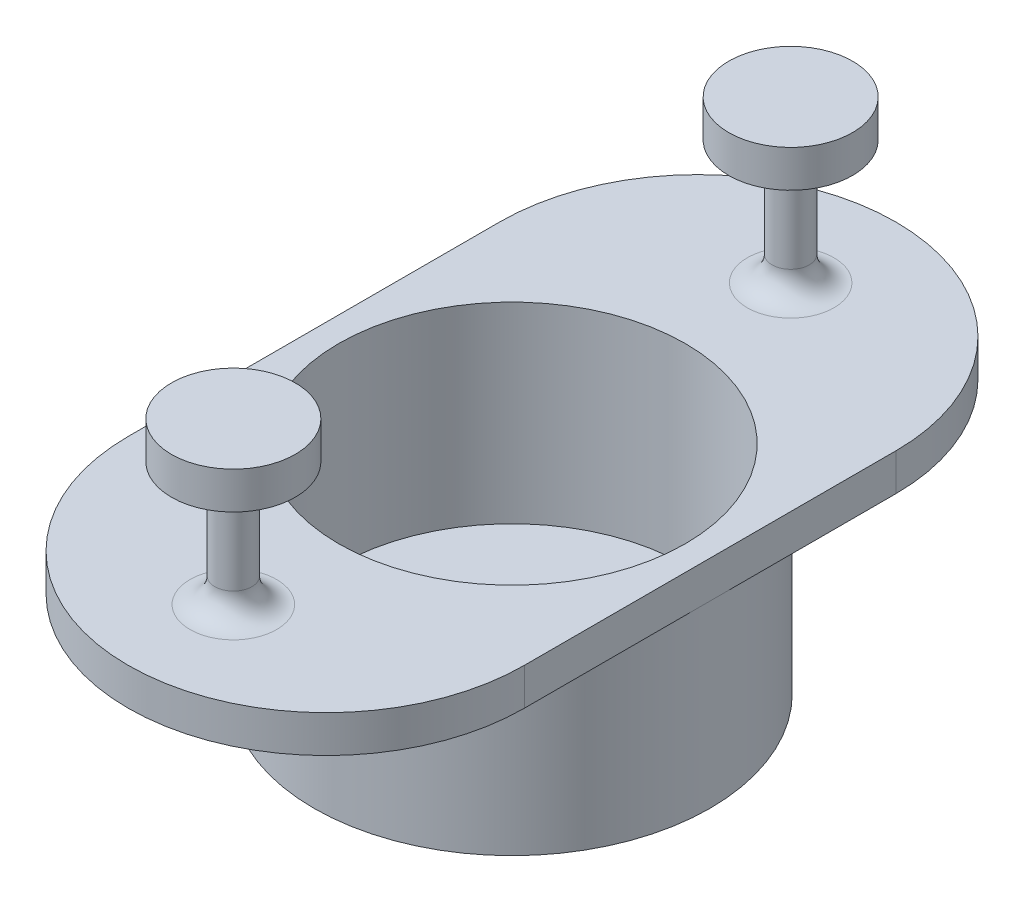
from build123d import *

# Parameters (mm, degrees)
SKETCH1_R           = 16
BOSS_EXTRUDE1_DEPTH = 14.5
BOSS_EXTRUDE2_DEPTH = 3
SKETCH3_R           = 1.5
BOSS_EXTRUDE3_DEPTH = 10
SKETCH4_R           = 14
CUT_EXTRUDE1_DEPTH  = 15.5
SKETCH5_R           = 1.5
CUT_EXTRUDE2_DEPTH  = 44.211688234
SKETCH7_R           = 5
BOSS_EXTRUDE4_DEPTH = 3
FILLET1_R           = 2


with BuildPart() as part:
    # Sketch1 → Boss-Extrude1 (new body)
    with BuildSketch(Plane(origin=(0, 0, 0), x_dir=(1, 0, 0), z_dir=(0, 1, 0))):
        with Locations(Location((0, 0, 0), (0, 0, 90))):
            Circle(SKETCH1_R)
    extrude(amount=BOSS_EXTRUDE1_DEPTH)

    # Sketch2 → Boss-Extrude2 (add)
    with BuildSketch(Plane(origin=(0, 14.5, 0), x_dir=(1, 0, 0), z_dir=(0, 1, 0))):
        with BuildLine():
            Line((-16, -15), (-16, 15))
            ThreePointArc((-16, 15), (0, 31), (16, 15))
            Line((16, 15), (16, -15))
            ThreePointArc((16, -15), (0, -31), (-16, -15))
        make_face()
    extrude(amount=BOSS_EXTRUDE2_DEPTH)

    # Sketch3 → Boss-Extrude3 (add)
    with BuildSketch(Plane(origin=(0, 17.5, 0), x_dir=(1, 0, 0), z_dir=(0, 1, 0))):
        with Locations(Location((0, 22.5, 0), (0, 0, 270))):
            Circle(SKETCH3_R)
        with Locations(Location((0, -22.5, 0), (0, 0, 270))):
            Circle(SKETCH3_R)
    extrude(amount=BOSS_EXTRUDE3_DEPTH)

    # Sketch4 → Cut-Extrude1 (cut)
    with BuildSketch(Plane(origin=(0, 17.5, 0), x_dir=(1, 0, 0), z_dir=(0, 1, 0))):
        with Locations(Location((0, 0, 0), (0, 0, 270))):
            Circle(SKETCH4_R)
    extrude(amount=-CUT_EXTRUDE1_DEPTH, mode=Mode.SUBTRACT)

    # Sketch5 → Cut-Extrude2 (cut, through all)
    with BuildSketch(Plane(origin=(0, 2, 0), x_dir=(1, 0, 0), z_dir=(0, 1, 0))):
        with Locations(Location((7.5, 0, 0), (0, 0, 270))):
            Circle(SKETCH5_R)
        with Locations(Location((-7.5, 0, 0), (0, 0, 270))):
            Circle(SKETCH5_R)
    extrude(amount=-CUT_EXTRUDE2_DEPTH, mode=Mode.SUBTRACT)

    # Sketch7 → Boss-Extrude4 (add)
    with BuildSketch(Plane(origin=(0, 27.5, 0), x_dir=(1, 0, 0), z_dir=(0, 1, 0))):
        with Locations(Location((0, 22.5, 0), (0, 0, 270))):
            Circle(SKETCH7_R)
        with Locations(Location((0, -22.5, 0), (0, 0, 270))):
            Circle(SKETCH7_R)
    extrude(amount=BOSS_EXTRUDE4_DEPTH)

    # Fillet1
    fillet1_edges = [part.edges().sort_by_distance(p)[0] for p in [
        (0, 17.5, -24),
        (0, 27.5, -24),
        (0, 17.5, 21),
        (0, 27.5, 21),
    ]]
    fillet(fillet1_edges, radius=FILLET1_R)


solid = part.part
